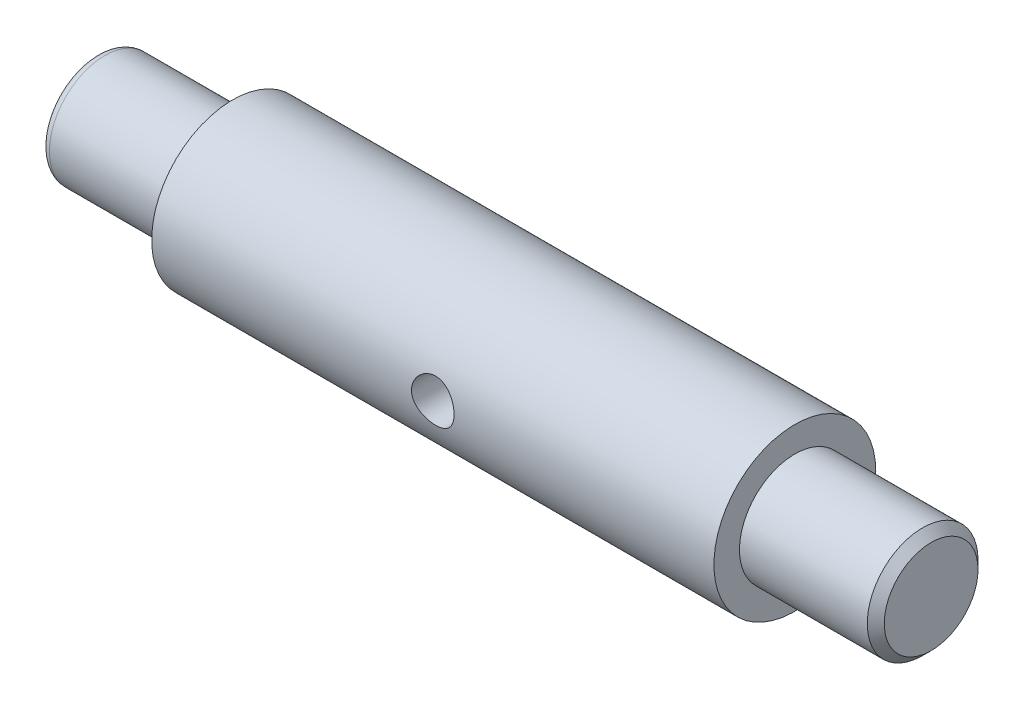
from build123d import *

# Parameters (mm, degrees)
CHAMFER1_SIZE      = 1
SKETCH5_R          = 3
CUT_EXTRUDE1_DEPTH = 60
SKETCH7_R          = 2.5
CUT_EXTRUDE2_DEPTH = 25


with BuildPart() as part:
    # Sketch3 → Revolve1 (revolve)
    with BuildSketch(Plane(origin=(0, 0, 0), x_dir=(1, 0, 0), z_dir=(0, 1, 0))):
        with BuildLine():
            Line((-33, 9.5), (33, 9.5))
            Line((33, 9.5), (33, 6.5))
            Line((33, 6.5), (49, 6.5))
            Line((49, 6.5), (49, 0))
            Line((49, 0), (-48, 0))
            Line((-48, 0), (-48, 3))
            Line((-48, 3), (-48.375, 3))
            ThreePointArc((-48.375, 3), (-48.816941738, 3.183058262), (-49, 3.625))
            Line((-49, 3.625), (-49, 5.5))
            ThreePointArc((-49, 5.5), (-48.707106781, 6.207106781), (-48, 6.5))
            Line((-48, 6.5), (-33, 6.5))
            Line((-33, 6.5), (-33, 9.5))
        make_face()
    revolve(axis=Axis((49, 0, 0), (-1, 0, 0)))

    # Chamfer1
    chamfer1_edges = [part.edges().sort_by_distance(p)[0] for p in [
        (49, 0, 6.5),
    ]]
    chamfer(chamfer1_edges, length=CHAMFER1_SIZE)

    # Sketch5 → Cut-Extrude1 (cut)
    with BuildSketch(Plane.ZY.offset(48)):
        with Locations(Location((0, 0, 0), (0, 0, 180))):
            Circle(SKETCH5_R)
    extrude(amount=-CUT_EXTRUDE1_DEPTH, mode=Mode.SUBTRACT)

    # Sketch7 → Cut-Extrude2 (cut, symmetric)
    with BuildSketch(Plane.XY):
        Circle(SKETCH7_R)
    extrude(amount=CUT_EXTRUDE2_DEPTH, both=True, mode=Mode.SUBTRACT)


solid = part.part
